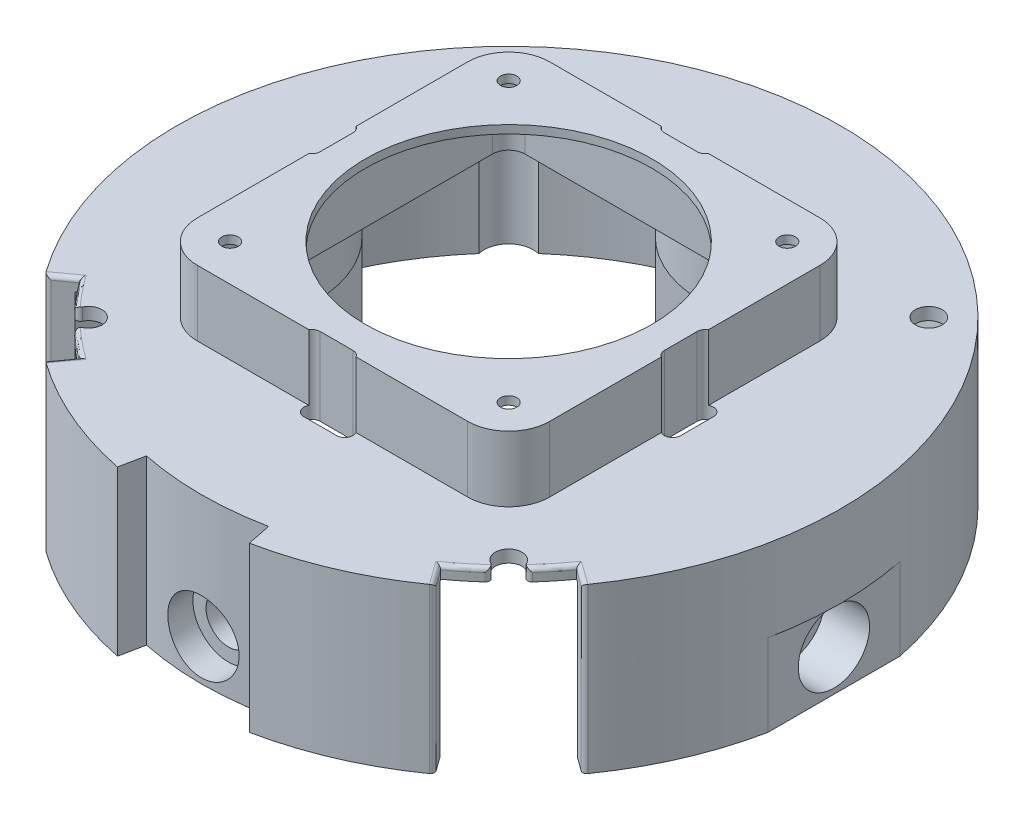
from build123d import *
from build123d.topology import SkipClean

# Parameters (mm, degrees)
SKETCH1_R               = 41.9
TOP_PART_DEPTH          = 15
SKETCH2_R               = 30
CUT_EXTRUDE1_DEPTH      = 20
FILLET1_R               = 1.5
CHAMFER1_SIZE           = 2
SKETCH8_7_R             = 1.625
CUT_EXTRUDE8_DEPTH      = 3
SKETCH8_R               = 1.625
CUT_EXTRUDE7_DEPTH      = 62.124627
CUT_EXTRUDE11_DEPTH     = 62.124627
SKETCH15_R              = 1.625
CUT_EXTRUDE14_DEPTH     = 10
CUT_EXTRUDE15_DEPTH     = 10
CIRPATTERN1_COUNT       = 4
CIRPATTERN2_COUNT       = 4
SKETCH3_R               = 41.9
BOTTOM_PART_DEPTH       = 20
SKETCH6_R               = 37.9
CUT_EXTRUDE3_DEPTH      = 63.076324
SKETCH_1_W              = 43
SKETCH_1_H              = 43
EXTRUDE_1_DEPTH         = 8
FILLET_1_R              = 5
CUT_EXTRUDE4_DEPTH      = 63.076324
CUT_EXTRUDE4_DEPTH_BACK = 63.076324
SKETCH7_R               = 17.5
SKETCH7_R_2             = 1
SKETCH12_W              = 39.5
SKETCH12_H              = 39.5
CUT_EXTRUDE10_DEPTH     = 8.5
FILLET3_R               = 2
SKETCH17_R              = 1.625
CUT_EXTRUDE16_DEPTH     = 63.076324
SKETCH18_R              = 3
CUT_EXTRUDE17_DEPTH     = 63.076324
BOSS_EXTRUDE1_DEPTH     = 8.5
BOSS_EXTRUDE2_DEPTH     = 10
CUT_EXTRUDE18_DEPTH     = 10
SKETCH28_R              = 2.75
CUT_EXTRUDE19_DEPTH     = 13
SKETCH29_R              = 4.35
CUT_EXTRUDE20_DEPTH     = 5.5
CIRPATTERN3_COUNT       = 4
SKETCH30_W              = 20
SKETCH30_H              = 9.213517
CUT_EXTRUDE21_DEPTH     = 15
SKETCH31_R              = 41.9
SKETCH31_R_2            = 30
CUT_EXTRUDE22_DEPTH     = 15
SKETCH32_R              = 43.058985
SKETCH32_R_2            = 40.5
CUT_EXTRUDE23_DEPTH     = 66.537928
CUT_EXTRUDE24_DEPTH     = 64.753431
FILLET4_R               = 0.5
CUT_EXTRUDE25_DEPTH     = 61.189285


with BuildPart() as part:
    # Sketch1 → Top-Part (new body)
    with BuildSketch(Plane(origin=(0, 0, 0), x_dir=(1, 0, 0), z_dir=(0, 1, 0))):
        with Locations(Location((0, 0, 0), (0, 0, 270))):
            Circle(SKETCH1_R)
    extrude(amount=TOP_PART_DEPTH)

    # Sketch2 → Cut-Extrude1 (cut)
    with BuildSketch(Plane(origin=(0, 15, 0), x_dir=(1, 0, 0), z_dir=(0, 1, 0))):
        with Locations(Location((0, 0, 0), (0, 0, 270))):
            Circle(SKETCH2_R)
    extrude(amount=-CUT_EXTRUDE1_DEPTH, mode=Mode.SUBTRACT)

    # Fillet1
    fillet1_edges = [part.edges().sort_by_distance(p)[0] for p in [
        (0, 15, -41.9),
    ]]
    fillet(fillet1_edges, radius=FILLET1_R)

    # Chamfer1
    chamfer1_edges = [part.edges().sort_by_distance(p)[0] for p in [
        (0, 15, -30),
    ]]
    chamfer(chamfer1_edges, length=CHAMFER1_SIZE)

    # Sketch8<7> → Cut-Extrude8 (cut)
    # profile 1 of 4: a face of its own
    with BuildSketch(Plane(origin=(0, 15, 0), x_dir=(1, 0, 0), z_dir=(0, 1, 0))):
        Polygon((25.083214, 22.516777), (28.056317, 23.598898), (28.605724, 26.714742), (26.182028, 28.748464), (23.208925, 27.666343), (22.659518, 24.5505), align=None)
        with Locations(Location((25.632621, 25.632621, 0), (0, 0, 270))):
            Circle(SKETCH8_7_R, mode=Mode.SUBTRACT)
    # profile 2 of 4: a face of its own
    with BuildSketch(Plane(origin=(0, 15, 0), x_dir=(1, 0, 0), z_dir=(0, 1, 0))):
        Polygon((-22.516777, 25.083214), (-23.598898, 28.056317), (-26.714742, 28.605724), (-28.748464, 26.182028), (-27.666343, 23.208925), (-24.5505, 22.659518), align=None)
        with Locations(Location((-25.632621, 25.632621, 0), (0, 0, 270))):
            Circle(SKETCH8_7_R, mode=Mode.SUBTRACT)
    # profile 3 of 4: a face of its own
    with BuildSketch(Plane(origin=(0, 15, 0), x_dir=(1, 0, 0), z_dir=(0, 1, 0))):
        Polygon((22.516777, -25.083214), (23.598898, -28.056317), (26.714742, -28.605724), (28.748464, -26.182028), (27.666343, -23.208925), (24.5505, -22.659518), align=None)
        with Locations(Location((25.632621, -25.632621, 0), (0, 0, 270))):
            Circle(SKETCH8_7_R, mode=Mode.SUBTRACT)
    # profile 4 of 4: a face of its own
    with BuildSketch(Plane(origin=(0, 15, 0), x_dir=(1, 0, 0), z_dir=(0, 1, 0))):
        Polygon((-25.083214, -22.516777), (-28.056317, -23.598898), (-28.605724, -26.714742), (-26.182028, -28.748464), (-23.208925, -27.666343), (-22.659518, -24.5505), align=None)
        with Locations(Location((-25.632621, -25.632621, 0), (0, 0, 270))):
            Circle(SKETCH8_7_R, mode=Mode.SUBTRACT)
    extrude(amount=-CUT_EXTRUDE8_DEPTH, mode=Mode.SUBTRACT)

    # Sketch8 → Cut-Extrude7 (cut, through all)
    with BuildSketch(Plane(origin=(0, 15, 0), x_dir=(1, 0, 0), z_dir=(0, 1, 0))):
        with Locations(Location((-25.632621, 25.632621, 0), (0, 0, 270))):
            Circle(SKETCH8_R)
        with Locations(Location((25.632621, 25.632621, 0), (0, 0, 270))):
            Circle(SKETCH8_R)
        with Locations(Location((25.632621, -25.632621, 0), (0, 0, 270))):
            Circle(SKETCH8_R)
        with Locations(Location((-25.632621, -25.632621, 0), (0, 0, 270))):
            Circle(SKETCH8_R)
    extrude(amount=-CUT_EXTRUDE7_DEPTH, mode=Mode.SUBTRACT)

    # Sketch13 → Cut-Extrude11 (cut, through all)
    with BuildSketch(Plane.XZ):
        with BuildLine():
            Line((-10, 35.51915), (-10, 40.689188))
            ThreePointArc((-10, 40.689188), (0, 41.9), (10, 40.689188))
            Line((10, 40.689188), (10, 35.51915))
            ThreePointArc((10, 35.51915), (0, 36.9), (-10, 35.51915))
        make_face()
    extrude(amount=-CUT_EXTRUDE11_DEPTH, mode=Mode.SUBTRACT)

    # Sketch15 → Cut-Extrude14 (cut, symmetric)
    with BuildSketch(Plane.XY.offset(32.4)):
        with Locations(Location((0, 7.5, 0), (0, 0, 180))):
            Circle(SKETCH15_R)
    cut_extrude14 = extrude(amount=CUT_EXTRUDE14_DEPTH, both=True, mode=Mode.SUBTRACT)

    # Sketch16 → Cut-Extrude15 (cut)
    with BuildSketch(Plane.XY.offset(32.4)):
        Polygon((3.377499, 7.5), (1.68875, 10.425), (-1.68875, 10.425), (-3.377499, 7.5), (-1.68875, 4.575), (1.68875, 4.575), align=None)
    cut_extrude15 = extrude(amount=-CUT_EXTRUDE15_DEPTH, mode=Mode.SUBTRACT)

    # CirPattern1: Cut-Extrude14 ×4 about axis
    cirpattern1_axis = Axis((0, 0, 0), (0, 1, 0))
    for i in range(1, CIRPATTERN1_COUNT):
        add(cut_extrude14.rotate(cirpattern1_axis, i * 360 / CIRPATTERN1_COUNT), mode=Mode.SUBTRACT)

    # CirPattern2: Cut-Extrude15 ×4 about axis
    cirpattern2_axis = Axis((0, 0, 0), (0, 1, 0))
    for i in range(1, CIRPATTERN2_COUNT):
        add(cut_extrude15.rotate(cirpattern2_axis, i * 360 / CIRPATTERN2_COUNT), mode=Mode.SUBTRACT)

    # Sketch30 → Cut-Extrude21 (cut)
    with BuildSketch(Plane(origin=(0, 15, 0), x_dir=(1, 0, 0), z_dir=(0, 1, 0))):
        with Locations((0, -39.506758)):
            Rectangle(SKETCH30_W, SKETCH30_H)
    extrude(amount=-CUT_EXTRUDE21_DEPTH, mode=Mode.SUBTRACT)

    # Sketch31 → Cut-Extrude22 (cut)
    with BuildSketch(Plane(origin=(0, 15, 0), x_dir=(1, 0, 0), z_dir=(0, 1, 0))):
        with Locations(Location((0, 0, 0), (0, 0, 251.31541))):
            Circle(SKETCH31_R)
        Circle(SKETCH31_R_2, mode=Mode.SUBTRACT)
    extrude(amount=-CUT_EXTRUDE22_DEPTH, mode=Mode.SUBTRACT)


with BuildPart() as body_2:
    # Sketch3 → Bottom-Part (new body)
    with BuildSketch(Plane.XZ):
        with Locations(Location((0, 0, 0), (0, 0, 270))):
            Circle(SKETCH3_R)
    extrude(amount=BOTTOM_PART_DEPTH)

    # Sketch6 → Cut-Extrude3 (cut, through all)
    with BuildSketch(Plane(origin=(0, -1.5, 0), x_dir=(1, 0, 0), z_dir=(0, 1, 0))):
        with Locations(Location((0, 0, 0), (0, 0, 270))):
            Circle(SKETCH6_R)
    extrude(amount=-CUT_EXTRUDE3_DEPTH, mode=Mode.SUBTRACT)

    # ｽｹｯﾁ1 → ﾎﾞｽ - 押し出し1 (add)
    with BuildSketch(Plane(origin=(0, 0, 0), x_dir=(1, 0, 0), z_dir=(0, 1, 0))):
        Rectangle(SKETCH_1_W, SKETCH_1_H)
    extrude(amount=EXTRUDE_1_DEPTH)

    # ﾌｨﾚｯﾄ1
    fillet_1_edges = [body_2.edges().sort_by_distance(p)[0] for p in [
        (-21.5, 4, -21.5),
        (-21.5, 4, 21.5),
        (21.5, 4, 21.5),
        (21.5, 4, -21.5),
    ]]
    fillet(fillet_1_edges, radius=FILLET_1_R)

    # Sketch7 → Cut-Extrude4 (cut, two sides: drawn at the far end of the back side and taken through both)
    with BuildSketch(Plane(origin=(0, -1.5, 0), x_dir=(1, 0, 0), z_dir=(0, 1, 0)).offset(-CUT_EXTRUDE4_DEPTH_BACK)):
        with Locations(Location((0, 0, 0), (0, 0, 270))):
            Circle(SKETCH7_R)
        with Locations(Location((17, -17, 0), (0, 0, 270))):
            Circle(SKETCH7_R_2)
        with Locations(Location((-17, -17, 0), (0, 0, 270))):
            Circle(SKETCH7_R_2)
        with Locations(Location((-17, 17, 0), (0, 0, 270))):
            Circle(SKETCH7_R_2)
        with Locations(Location((17, 17, 0), (0, 0, 270))):
            Circle(SKETCH7_R_2)
    extrude(amount=CUT_EXTRUDE4_DEPTH + CUT_EXTRUDE4_DEPTH_BACK, mode=Mode.SUBTRACT)

    # Sketch12 → Cut-Extrude10 (cut)
    with BuildSketch(Plane.XZ.offset(1.5)):
        Rectangle(SKETCH12_W, SKETCH12_H)
    extrude(amount=-CUT_EXTRUDE10_DEPTH, mode=Mode.SUBTRACT)

    # Fillet3
    fillet3_edges = [body_2.edges().sort_by_distance(p)[0] for p in [
        (-19.75, 2.75, -19.75),
        (-19.75, 2.75, 19.75),
        (19.75, 2.75, 19.75),
        (19.75, 2.75, -19.75),
    ]]
    fillet(fillet3_edges, radius=FILLET3_R)

    # Sketch17 → Cut-Extrude16 (cut, through all)
    with BuildSketch(Plane.XZ.offset(1.5)):
        with Locations(Location((25.632621, -25.632621, 0), (0, 0, 270))):
            Circle(SKETCH17_R)
        with Locations(Location((-25.632621, -25.632621, 0), (0, 0, 270))):
            Circle(SKETCH17_R)
        with Locations(Location((25.632621, 25.632621, 0), (0, 0, 270))):
            Circle(SKETCH17_R)
        with Locations(Location((-25.632621, 25.632621, 0), (0, 0, 270))):
            Circle(SKETCH17_R)
    extrude(amount=-CUT_EXTRUDE16_DEPTH, mode=Mode.SUBTRACT)

    # Sketch18 → Cut-Extrude17 (cut, through all)
    with BuildSketch(Plane.XZ.offset(1.5)):
        with Locations((-25.632621, 25.632621)):
            Circle(SKETCH18_R)
        with Locations((25.632621, 25.632621)):
            Circle(SKETCH18_R)
        with Locations((25.632621, -25.632621)):
            Circle(SKETCH18_R)
        with Locations((-25.632621, -25.632621)):
            Circle(SKETCH18_R)
    extrude(amount=CUT_EXTRUDE17_DEPTH, mode=Mode.SUBTRACT)

    # Sketch19 → Boss-Extrude1 (add)
    with BuildSketch(Plane.XZ.offset(1.5)):
        with BuildLine():
            ThreePointArc((35.443375, 13.42301), (23.487033, 0), (35.443375, -13.42301))
            ThreePointArc((35.443375, -13.42301), (37.9, 0), (35.443375, 13.42301))
        make_face()
        with BuildLine():
            ThreePointArc((-13.42301, 35.443375), (0, 23.487033), (13.42301, 35.443375))
            ThreePointArc((13.42301, 35.443375), (0, 37.9), (-13.42301, 35.443375))
        make_face()
        with BuildLine():
            ThreePointArc((13.42301, -35.443375), (0, -23.487033), (-13.42301, -35.443375))
            ThreePointArc((-13.42301, -35.443375), (0, -37.9), (13.42301, -35.443375))
        make_face()
        with BuildLine():
            ThreePointArc((-35.443375, -13.42301), (-23.487033, 0), (-35.443375, 13.42301))
            ThreePointArc((-35.443375, 13.42301), (-37.9, 0), (-35.443375, -13.42301))
        make_face()
    extrude(amount=BOSS_EXTRUDE1_DEPTH)

    # Sketch23 → Boss-Extrude2 (add)
    with SkipClean():  # the faces are left unmerged after this step: merging them gives an invalid solid
        with BuildSketch(Plane.XZ.offset(10)):
            with BuildLine():
                Line((9.707743, -27.6), (-9.707743, -27.6))
                ThreePointArc((-9.707743, -27.6), (-12.212189, -31.215304), (-13.42301, -35.443375))
                ThreePointArc((-13.42301, -35.443375), (0, -37.9), (13.42301, -35.443375))
                ThreePointArc((13.42301, -35.443375), (12.212189, -31.215304), (9.707743, -27.6))
            make_face()
            with BuildLine():
                Line((27.6, -9.707743), (27.6, 9.707743))
                ThreePointArc((27.6, 9.707743), (31.215304, 12.212189), (35.443375, 13.42301))
                ThreePointArc((35.443375, 13.42301), (37.9, 0), (35.443375, -13.42301))
                ThreePointArc((35.443375, -13.42301), (31.215304, -12.212189), (27.6, -9.707743))
            make_face()
            with BuildLine():
                Line((9.707743, 27.6), (-9.707743, 27.6))
                ThreePointArc((-9.707743, 27.6), (-12.212189, 31.215304), (-13.42301, 35.443375))
                ThreePointArc((-13.42301, 35.443375), (0, 37.9), (13.42301, 35.443375))
                ThreePointArc((13.42301, 35.443375), (12.212189, 31.215304), (9.707743, 27.6))
            make_face()
            with BuildLine():
                Line((-27.6, -9.707743), (-27.6, 9.707743))
                ThreePointArc((-27.6, 9.707743), (-31.215304, 12.212189), (-35.443375, 13.42301))
                ThreePointArc((-35.443375, 13.42301), (-37.9, 0), (-35.443375, -13.42301))
                ThreePointArc((-35.443375, -13.42301), (-31.215304, -12.212189), (-27.6, -9.707743))
            make_face()
        extrude(amount=BOSS_EXTRUDE2_DEPTH)

    # Sketch27 → Cut-Extrude18 (cut)
    with SkipClean():  # the faces are left unmerged after this step: merging them gives an invalid solid
        with BuildSketch(Plane.XZ.offset(20)):
            with BuildLine():
                Line((39.691722, 13.42301), (39.691722, -13.42301))
                ThreePointArc((39.691722, -13.42301), (41.9, 0), (39.691722, 13.42301))
            make_face()
            with BuildLine():
                Line((-13.42301, 39.691722), (13.42301, 39.691722))
                ThreePointArc((13.42301, 39.691722), (0, 41.9), (-13.42301, 39.691722))
            make_face()
            with BuildLine():
                Line((13.42301, -39.691722), (-13.42301, -39.691722))
                ThreePointArc((-13.42301, -39.691722), (0, -41.9), (13.42301, -39.691722))
            make_face()
            with BuildLine():
                Line((-39.691722, -13.42301), (-39.691722, 13.42301))
                ThreePointArc((-39.691722, 13.42301), (-41.9, 0), (-39.691722, -13.42301))
            make_face()
        extrude(amount=-CUT_EXTRUDE18_DEPTH, mode=Mode.SUBTRACT)

    # Sketch28 → Cut-Extrude19 (cut)
    with SkipClean():  # the faces are left unmerged after this step: merging them gives an invalid solid
        with BuildSketch(Plane.XY.offset(39.691722)):
            with Locations((0, -15)):
                Circle(SKETCH28_R)
        cut_extrude19 = extrude(amount=-CUT_EXTRUDE19_DEPTH, mode=Mode.SUBTRACT)

    # Sketch29 → Cut-Extrude20 (cut)
    with SkipClean():  # the faces are left unmerged after this step: merging them gives an invalid solid
        with BuildSketch(Plane.XY.offset(39.691722)):
            with Locations((0, -15)):
                Circle(SKETCH29_R)
        cut_extrude20 = extrude(amount=-CUT_EXTRUDE20_DEPTH, mode=Mode.SUBTRACT)

    # CirPattern3: Cut-Extrude19, Cut-Extrude20 ×4 about axis
    with SkipClean():  # the faces are left unmerged after this step: merging them gives an invalid solid
        cirpattern3_axis = Axis((0, 0, 0), (0, 1, 0))
        add([cut_extrude19.rotate(cirpattern3_axis, i * 360 / CIRPATTERN3_COUNT) for i in range(1, CIRPATTERN3_COUNT)], mode=Mode.SUBTRACT)
        add([cut_extrude20.rotate(cirpattern3_axis, i * 360 / CIRPATTERN3_COUNT) for i in range(1, CIRPATTERN3_COUNT)], mode=Mode.SUBTRACT)

    # Sketch32 → Cut-Extrude23 (cut, through all)
    with SkipClean():  # the faces are left unmerged after this step: merging them gives an invalid solid
        with BuildSketch(Plane.XZ.offset(20)):
            Circle(SKETCH32_R)
            with Locations(Location((0, 0, 0), (0, 0, 270))):
                Circle(SKETCH32_R_2, mode=Mode.SUBTRACT)
        extrude(amount=-CUT_EXTRUDE23_DEPTH, mode=Mode.SUBTRACT)

    # Sketch33 → Cut-Extrude24 (cut, through all)
    with SkipClean():  # the faces are left unmerged after this step: merging them gives an invalid solid
        with BuildSketch(Plane.XZ.offset(20)):
            with BuildLine():
                Line((-22.041947, 30.338137), (-23.805303, 32.765188))
                ThreePointArc((-23.805303, 32.765188), (-28.637825, 28.637825), (-32.765188, 23.805303))
                Line((-32.765188, 23.805303), (-30.338137, 22.041947))
                ThreePointArc((-30.338137, 22.041947), (-26.516504, 26.516504), (-22.041947, 30.338137))
            make_face()
            with BuildLine():
                Line((7.454548, 36.751595), (8.050912, 39.691722))
                ThreePointArc((8.050912, 39.691722), (0, 40.5), (-8.050912, 39.691722))
                Line((-8.050912, 39.691722), (-7.454548, 36.751595))
                ThreePointArc((-7.454548, 36.751595), (0, 37.5), (7.454548, 36.751595))
            make_face()
            with BuildLine():
                Line((22.041947, 30.338137), (23.805303, 32.765188))
                ThreePointArc((23.805303, 32.765188), (28.637825, 28.637825), (32.765188, 23.805303))
                Line((32.765188, 23.805303), (30.338137, 22.041947))
                ThreePointArc((30.338137, 22.041947), (26.516504, 26.516504), (22.041947, 30.338137))
            make_face()
        extrude(amount=-CUT_EXTRUDE24_DEPTH, mode=Mode.SUBTRACT)

    # Fillet4
    fillet4_edges = [body_2.edges().sort_by_distance(p)[0] for p in [
        (-32.765188, -10, 23.805303),
        (-23.805303, -10, 32.765188),
        (23.805303, -10, 32.765188),
        (32.765188, -10, 23.805303),
        (25.759303, -0.75, 27.252675),
        (27.252675, -0.75, 25.759303),
        (-27.252675, -0.75, 25.759303),
        (-25.759303, -0.75, 27.252675),
        (28.855331, 0, 23.950363),
        (23.950363, 0, 28.855331),
        (31.551663, 0, 22.923625),
        (22.923625, 0, 31.551663),
        (-23.950363, 0, 28.855331),
        (-28.855331, 0, 23.950363),
        (-22.923625, 0, 31.551663),
        (-31.551663, 0, 22.923625),
    ]]
    fillet(fillet4_edges, radius=FILLET4_R)

    # Sketch34 → Cut-Extrude25 (cut, through all)
    with SkipClean():  # the faces are left unmerged after this step: merging them gives an invalid solid
        with BuildSketch(Plane.XZ.offset(1.5)):
            with BuildLine():
                Line((23, 2), (23, -2))
                ThreePointArc((23, -2), (22, -3), (21, -2))
                Line((21, -2), (21, 2))
                ThreePointArc((21, 2), (22, 3), (23, 2))
            make_face()
            with BuildLine():
                Line((-2, 23), (2, 23))
                ThreePointArc((2, 23), (3, 22), (2, 21))
                Line((2, 21), (-2, 21))
                ThreePointArc((-2, 21), (-3, 22), (-2, 23))
            make_face()
            with BuildLine():
                Line((2, -23), (-2, -23))
                ThreePointArc((-2, -23), (-3, -22), (-2, -21))
                Line((-2, -21), (2, -21))
                ThreePointArc((2, -21), (3, -22), (2, -23))
            make_face()
            with BuildLine():
                Line((-23, -2), (-23, 2))
                ThreePointArc((-23, 2), (-22, 3), (-21, 2))
                Line((-21, 2), (-21, -2))
                ThreePointArc((-21, -2), (-22, -3), (-23, -2))
            make_face()
        extrude(amount=-CUT_EXTRUDE25_DEPTH, mode=Mode.SUBTRACT)


solid = body_2.part
